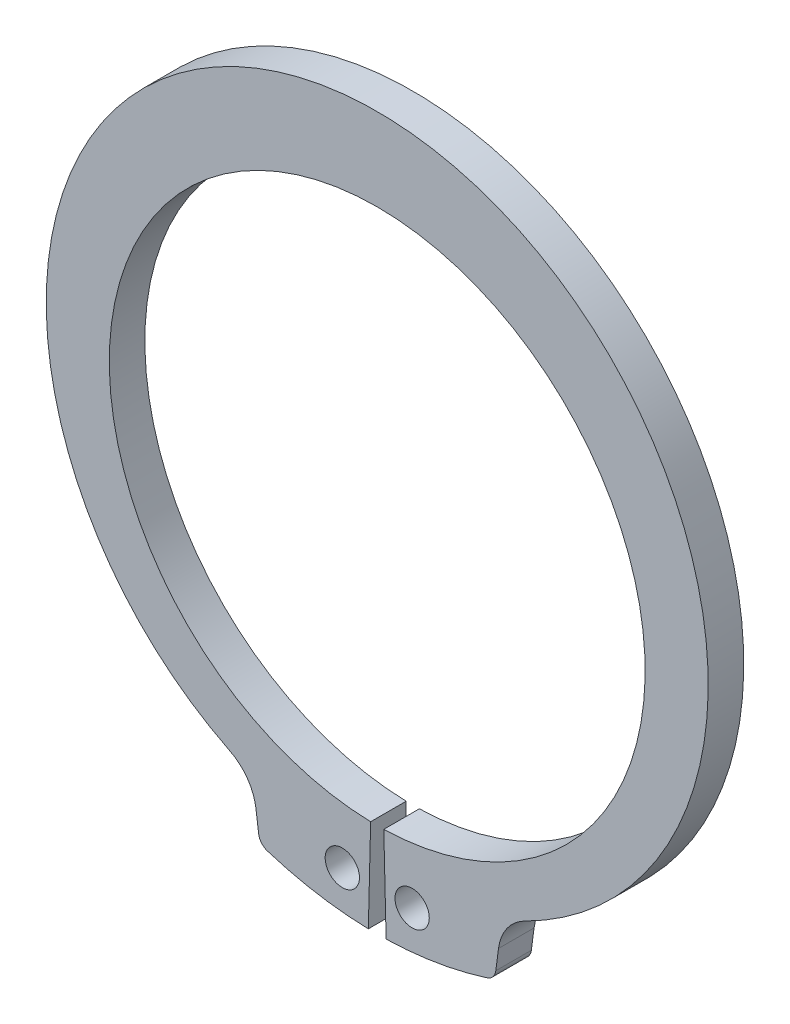
from build123d import *

# Parameters (mm, degrees)
BODYSKE_R  = 1.35
BODY_DEPTH = 2.8


with BuildPart() as part:
    # BodySke → Body (new body)
    with BuildSketch(Plane.XY):
        with BuildLine():
            Line((0.518245614, -21.09363462), (0.7, -28.491402212))
            ThreePointArc((0.7, -28.491402212), (4.721959722, -28.106104255), (8.649017415, -27.15592933))
            ThreePointArc((8.649017415, -27.15592933), (9.112520141, -26.84476427), (9.336987981, -26.333615896))
            Line((9.336987981, -26.333615896), (9.551937905, -24.700909129))
            ThreePointArc((9.551937905, -24.700909129), (10.22587295, -22.990373214), (11.624135819, -21.7966469))
            ThreePointArc((11.624135819, -21.7966469), (0, 27.6), (-11.624135819, -21.7966469))
            ThreePointArc((-11.624135819, -21.7966469), (-10.22587295, -22.990373214), (-9.551937905, -24.700909129))
            Line((-9.551937905, -24.700909129), (-9.336987981, -26.333615896))
            ThreePointArc((-9.336987981, -26.333615896), (-9.112520141, -26.84476427), (-8.649017415, -27.15592933))
            ThreePointArc((-8.649017415, -27.15592933), (-4.721959722, -28.106104255), (-0.7, -28.491402212))
            Line((-0.7, -28.491402212), (-0.518245614, -21.09363462))
            ThreePointArc((-0.518245614, -21.09363462), (0, 21.1), (0.518245614, -21.09363462))
        make_face()
        with Locations((2.75, -25.351282019)):
            Circle(BODYSKE_R, mode=Mode.SUBTRACT)
        with Locations((-2.75, -25.351282019)):
            Circle(BODYSKE_R, mode=Mode.SUBTRACT)
    extrude(amount=-BODY_DEPTH)


solid = part.part
